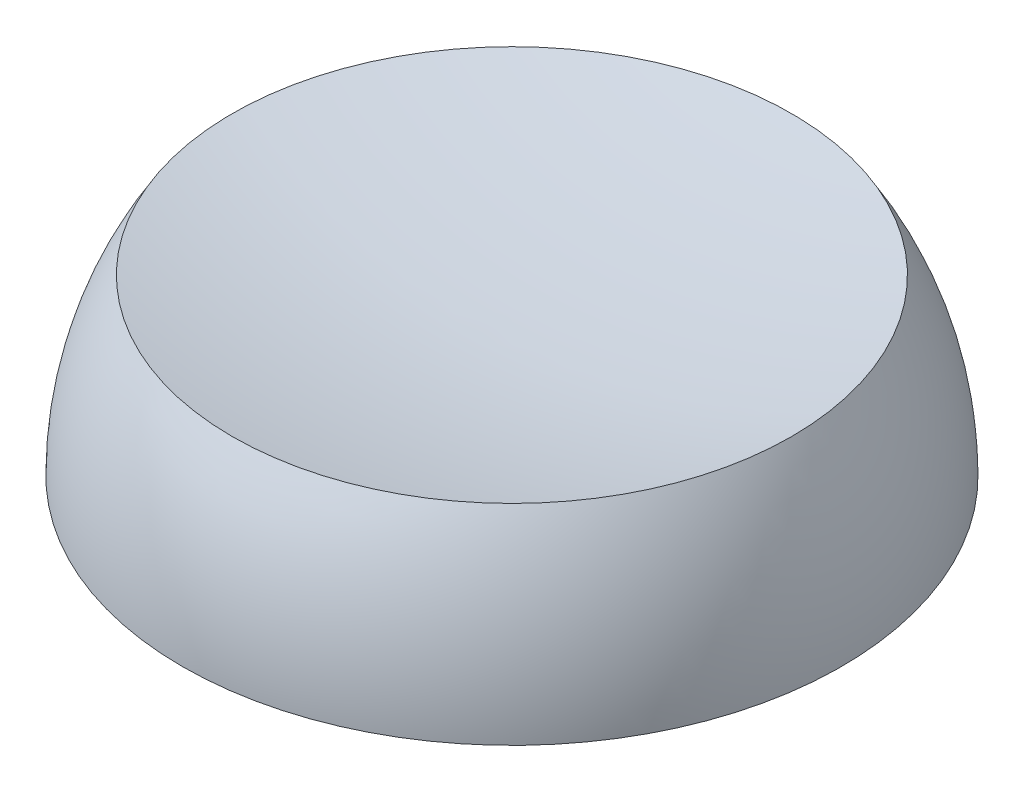
from build123d import *


with BuildPart() as part:
    # Sketch1 → Revolve1 (revolve)
    with BuildSketch(Plane.XY, mode=Mode.PRIVATE) as revolve1_sk:
        with BuildLine():
            Line((9, 0), (10, 0))
            ThreePointArc((10, 0), (9.614350858, 2.75031954), (8.487148486, 5.288507406))
            ThreePointArc((8.487148486, 5.288507406), (4.272203238, 4.548698582), (0, 4.300989002))
            Line((0, 4.300989002), (0, 3.300989002))
            ThreePointArc((0, 3.300989002), (4.015459576, 3.513939612), (7.985872471, 4.150402495))
            ThreePointArc((7.985872471, 4.150402495), (8.74279281, 2.136252298), (9, 0))
        make_face()
    revolve(revolve1_sk.sketch.rotate(Axis((0, 11.014623281, 0), (0, -1, 0)), 90), axis=Axis((0, 11.014623281, 0), (0, -1, 0)))


solid = part.part
